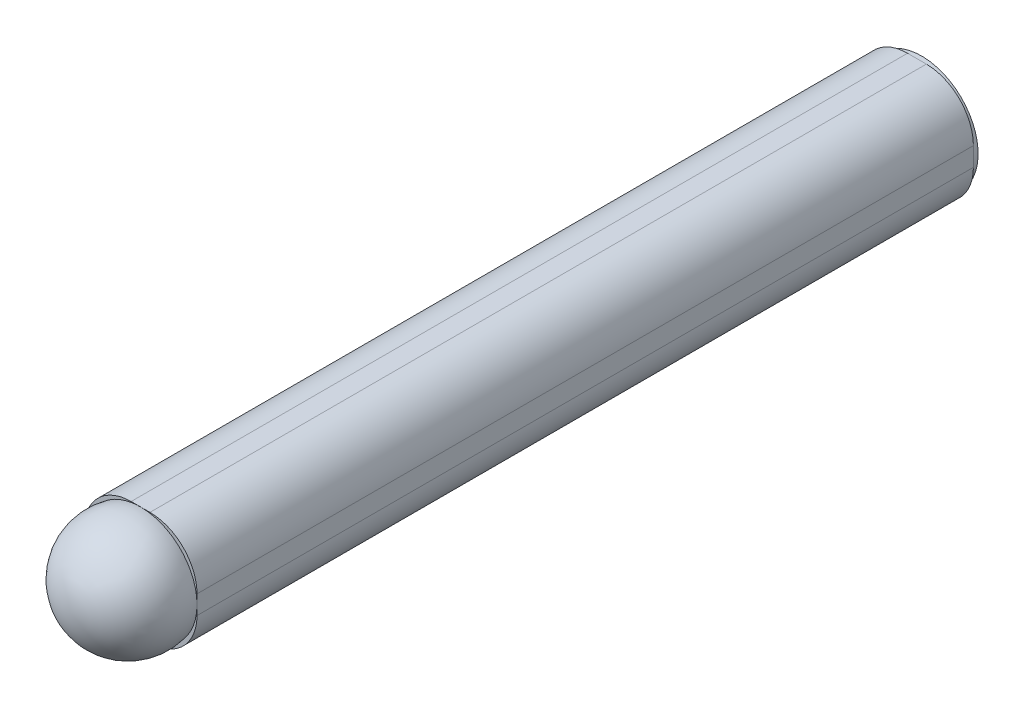
from build123d import *

# Parameters (mm, degrees)
SKETCH1_W           = 24
SKETCH1_H           = 24
BOSS_EXTRUDE1_DEPTH = 165
FILLET1_R           = 10
SKETCH4_R           = 12
BOSS_EXTRUDE2_DEPTH = 1


with BuildPart() as part:
    # Sketch1 → Boss-Extrude1 (new body)
    with BuildSketch(Plane.XY):
        Rectangle(SKETCH1_W, SKETCH1_H)
    extrude(amount=BOSS_EXTRUDE1_DEPTH)

    # Sketch3 → Revolve1 (revolve)
    with BuildSketch(Plane(origin=(0, 0, 0), x_dir=(-1, 0, 0), z_dir=(0, -1, 0))):
        with BuildLine():
            Line((0, -165), (0, -180))
            ThreePointArc((0, -180), (9.604686356, -175.383749085), (12, -165))
            Line((12, -165), (0, -165))
        make_face()
    revolve(axis=Axis((0, 0, 165), (0, 0, 1)))

    # Fillet1
    fillet1_edges = [part.edges().sort_by_distance(p)[0] for p in [
        (12, -12, 82.5),
        (-12, -12, 82.5),
        (-12, 12, 82.5),
        (12, 12, 82.5),
    ]]
    fillet(fillet1_edges, radius=FILLET1_R)

    # Sketch4 → Boss-Extrude2 (add)
    with BuildSketch(Plane(origin=(0, 0, 0), x_dir=(-1, 0, 0), z_dir=(0, 0, -1))):
        Circle(SKETCH4_R)
    extrude(amount=BOSS_EXTRUDE2_DEPTH)


solid = part.part
